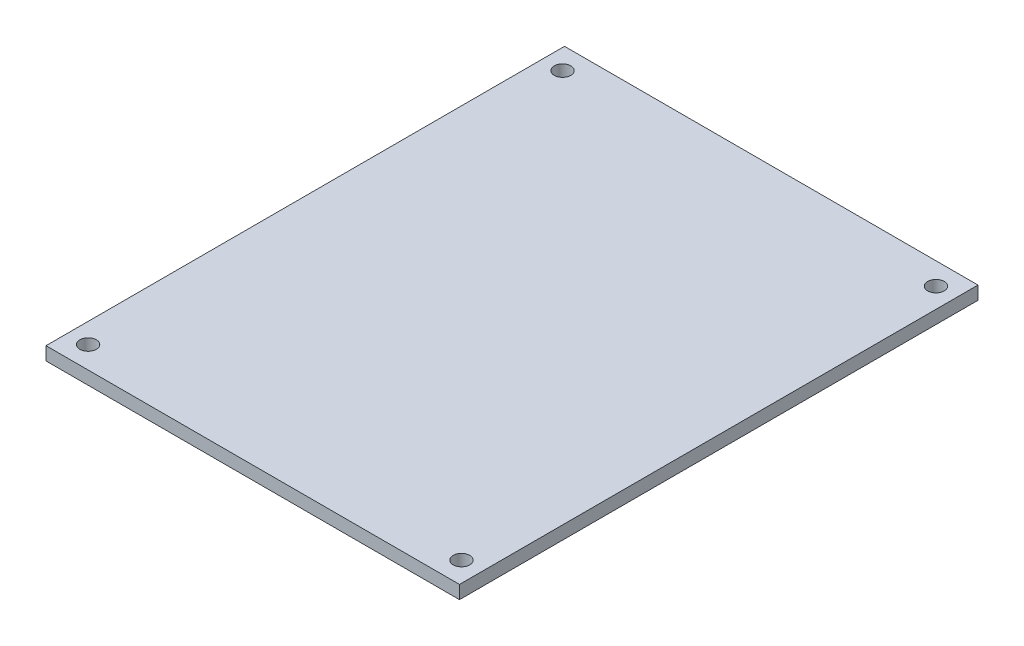
from build123d import *

# Parameters (mm, degrees)
SKETCH1_W           = 50.8
SKETCH1_H           = 63.7032
SKETCH1_R           = 1.016
BOSS_EXTRUDE1_DEPTH = 1.6256


with BuildPart() as part:
    # Sketch1 → Boss-Extrude1 (new body)
    with BuildSketch(Plane(origin=(0, 0, 0), x_dir=(1, 0, 0), z_dir=(0, 1, 0))):
        Rectangle(SKETCH1_W, SKETCH1_H)
        with Locations(Location((-22.9362, 29.1465, 0), (0, 0, 270))):
            Circle(SKETCH1_R, mode=Mode.SUBTRACT)
        with Locations(Location((22.9362, 29.1465, 0), (0, 0, 270))):
            Circle(SKETCH1_R, mode=Mode.SUBTRACT)
        with Locations(Location((22.9362, -29.1465, 0), (0, 0, 270))):
            Circle(SKETCH1_R, mode=Mode.SUBTRACT)
        with Locations(Location((-22.9362, -29.1465, 0), (0, 0, 270))):
            Circle(SKETCH1_R, mode=Mode.SUBTRACT)
    extrude(amount=BOSS_EXTRUDE1_DEPTH)


solid = part.part
